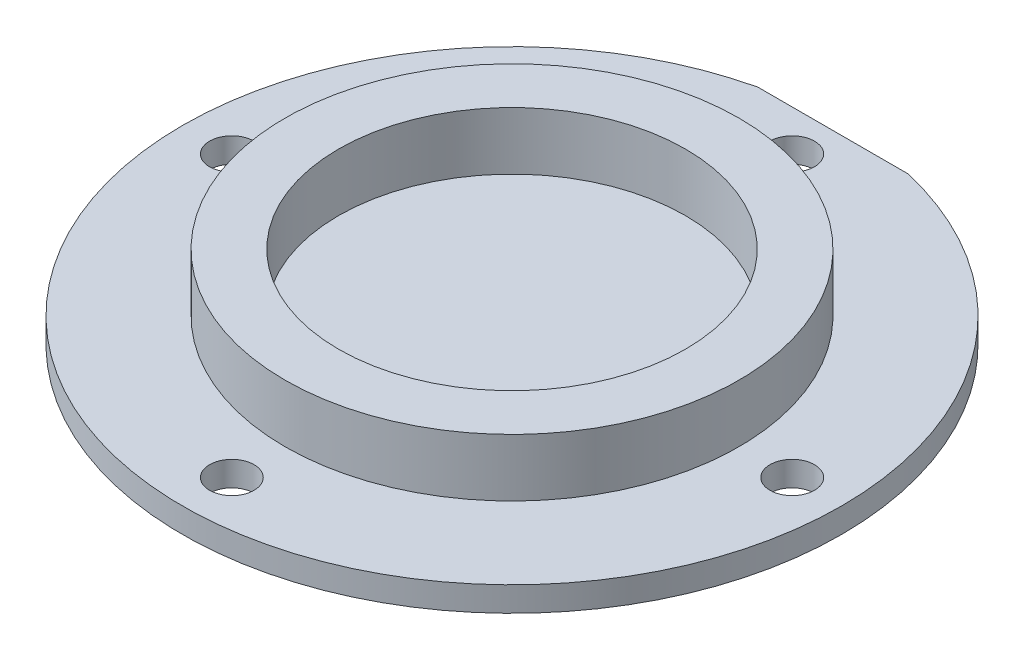
from build123d import *

# Parameters (mm, degrees)
SKETCH1_R           = 2.7
BOSS_EXTRUDE1_DEPTH = 3
SKETCH2_R           = 27.55
SKETCH2_R_2         = 21.05
BOSS_EXTRUDE2_DEPTH = 7


with BuildPart() as part:
    # Sketch1 → Boss-Extrude1 (new body)
    with BuildSketch(Plane(origin=(0, 0, 0), x_dir=(1, 0, 0), z_dir=(0, 1, 0))):
        with BuildLine():
            Line((-9.11971668, 38.946511624), (9.11971668, 38.946511624))
            ThreePointArc((9.11971668, 38.946511624), (0, -40), (-9.11971668, 38.946511624))
        make_face()
        with Locations(Location((0, 34.007379053, 0), (0, 0, 270))):
            Circle(SKETCH1_R, mode=Mode.SUBTRACT)
        with Locations(Location((34.007379053, 0, 0), (0, 0, 270))):
            Circle(SKETCH1_R, mode=Mode.SUBTRACT)
        with Locations(Location((-34.007379053, 0, 0), (0, 0, 270))):
            Circle(SKETCH1_R, mode=Mode.SUBTRACT)
        with Locations(Location((0, -34.007379053, 0), (0, 0, 270))):
            Circle(SKETCH1_R, mode=Mode.SUBTRACT)
    extrude(amount=BOSS_EXTRUDE1_DEPTH)

    # Sketch2 → Boss-Extrude2 (add)
    with BuildSketch(Plane(origin=(0, 3, 0), x_dir=(1, 0, 0), z_dir=(0, 1, 0))):
        with Locations(Location((0, 0, 0), (0, 0, 270))):
            Circle(SKETCH2_R)
        with Locations(Location((0, 0, 0), (0, 0, 270))):
            Circle(SKETCH2_R_2, mode=Mode.SUBTRACT)
    extrude(amount=BOSS_EXTRUDE2_DEPTH)


solid = part.part
